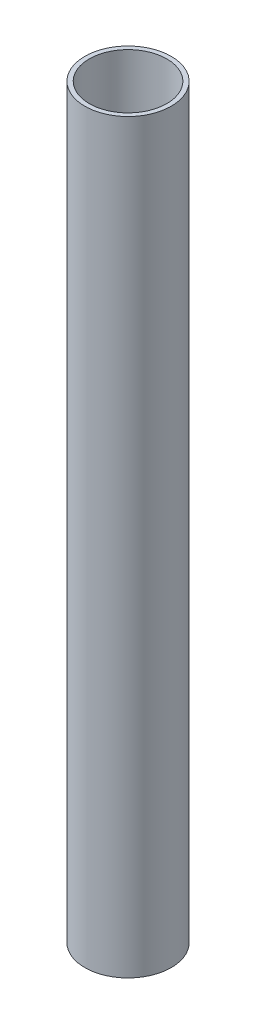
from build123d import *

# Parameters (mm, degrees)
SKETCH2_R   = 12.7
SKETCH2_R_2 = 11.4
TUBE_DEPTH  = 219.24


with BuildPart() as part:
    # Sketch2 → Tube (new body)
    with BuildSketch(Plane(origin=(0, 0, 0), x_dir=(1, 0, 0), z_dir=(0, 1, 0))):
        with Locations(Location((0, 0, 0), (0, 0, 90))):
            Circle(SKETCH2_R)
        with Locations(Location((0, 0, 0), (0, 0, 90))):
            Circle(SKETCH2_R_2, mode=Mode.SUBTRACT)
    extrude(amount=TUBE_DEPTH)


solid = part.part
